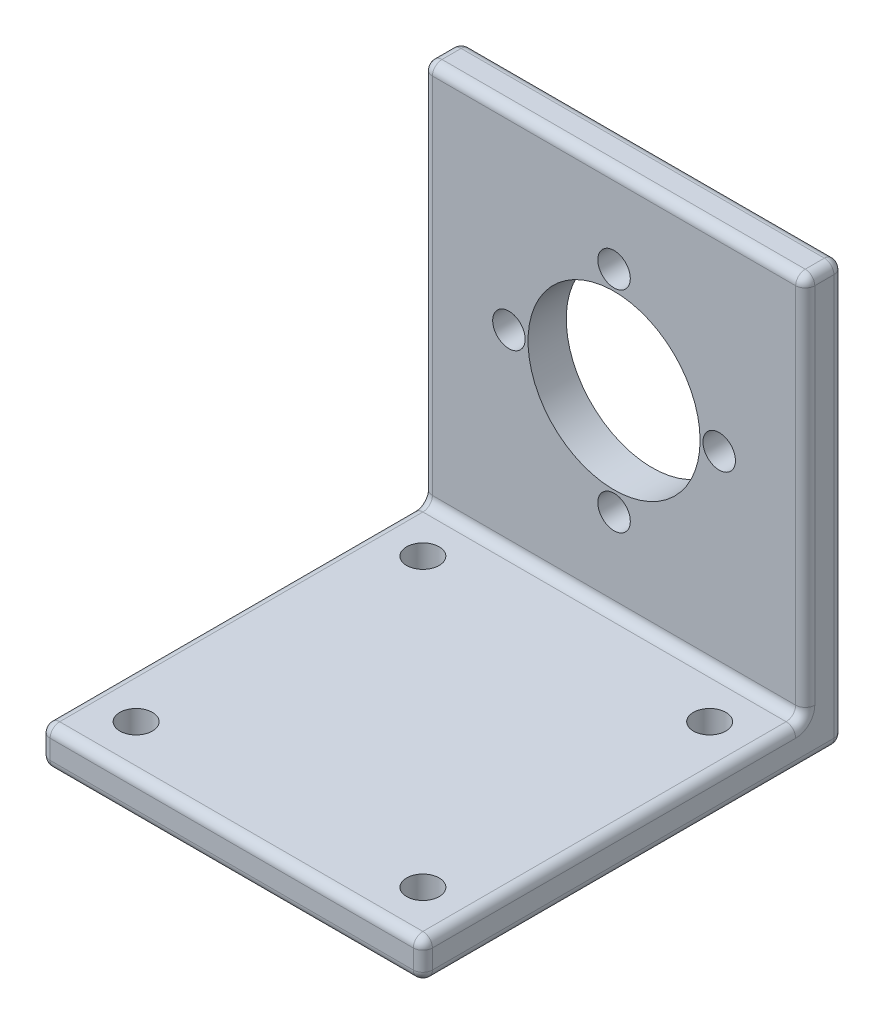
from build123d import *

# Parameters (mm, degrees)
SKETCH2_W           = 40
SKETCH2_H           = 44
BOSS_EXTRUDE1_DEPTH = 4
SKETCH4_W           = 40
SKETCH4_H           = 4
BOSS_EXTRUDE2_DEPTH = 40
SKETCH5_R           = 1.7
CUT_EXTRUDE1_DEPTH  = 72.665891469
SKETCH8_R           = 1.7
CUT_EXTRUDE4_DEPTH  = 72.665891469
FILLET2_R           = 1


with BuildPart() as part:
    # Sketch2 → Boss-Extrude1 (new body)
    with BuildSketch(Plane.XY):
        with Locations((20, 22)):
            Rectangle(SKETCH2_W, SKETCH2_H)
    extrude(amount=BOSS_EXTRUDE1_DEPTH)

    # Sketch4 → Boss-Extrude2 (add)
    with BuildSketch(Plane.XY.offset(4)):
        with Locations((20, 2)):
            Rectangle(SKETCH4_W, SKETCH4_H)
    extrude(amount=BOSS_EXTRUDE2_DEPTH)

    # Sketch5 → Cut-Extrude1 (cut, through all)
    with BuildSketch(Plane.XY.offset(4)):
        with BuildLine():
            ThreePointArc((29, 24), (26.363961031, 30.363961031), (20, 33))
            Line((20, 33), (20, 15))
            ThreePointArc((20, 15), (26.363961031, 17.636038969), (29, 24))
        make_face()
        with BuildLine():
            Line((20, 15), (20, 33))
            ThreePointArc((20, 33), (11, 24), (20, 15))
        make_face()
        with Locations((9, 24)):
            Circle(SKETCH5_R)
        with Locations((20, 35)):
            Circle(SKETCH5_R)
        with Locations((31, 24)):
            Circle(SKETCH5_R)
        with Locations((20, 13)):
            Circle(SKETCH5_R)
    extrude(amount=-CUT_EXTRUDE1_DEPTH, mode=Mode.SUBTRACT)

    # Sketch8 → Cut-Extrude4 (cut, through all)
    with BuildSketch(Plane(origin=(0, 4, 0), x_dir=(1, 0, 0), z_dir=(0, 1, 0))):
        with Locations(Location((5, -9, 0), (0, 0, 270))):
            Circle(SKETCH8_R)
        with Locations(Location((35, -9, 0), (0, 0, 270))):
            Circle(SKETCH8_R)
        with Locations(Location((35, -39, 0), (0, 0, 270))):
            Circle(SKETCH8_R)
        with Locations(Location((5, -39, 0), (0, 0, 270))):
            Circle(SKETCH8_R)
    extrude(amount=-CUT_EXTRUDE4_DEPTH, mode=Mode.SUBTRACT)

    # Fillet2
    fillet2_edges = [part.edges().sort_by_distance(p)[0] for p in [
        (40, 24, 4),
        (0, 4, 24),
        (20, 44, 4),
        (20, 4, 4),
        (40, 4, 24),
        (0, 2, 44),
        (20, 0, 44),
        (40, 2, 44),
        (20, 4, 44),
        (0, 24, 4),
        (20, 44, 0),
        (40, 22, 0),
        (20, 0, 0),
        (0, 22, 0),
        (0, 44, 2),
        (40, 44, 2),
        (40, 0, 22),
        (0, 0, 22),
    ]]
    fillet(fillet2_edges, radius=FILLET2_R)


solid = part.part
